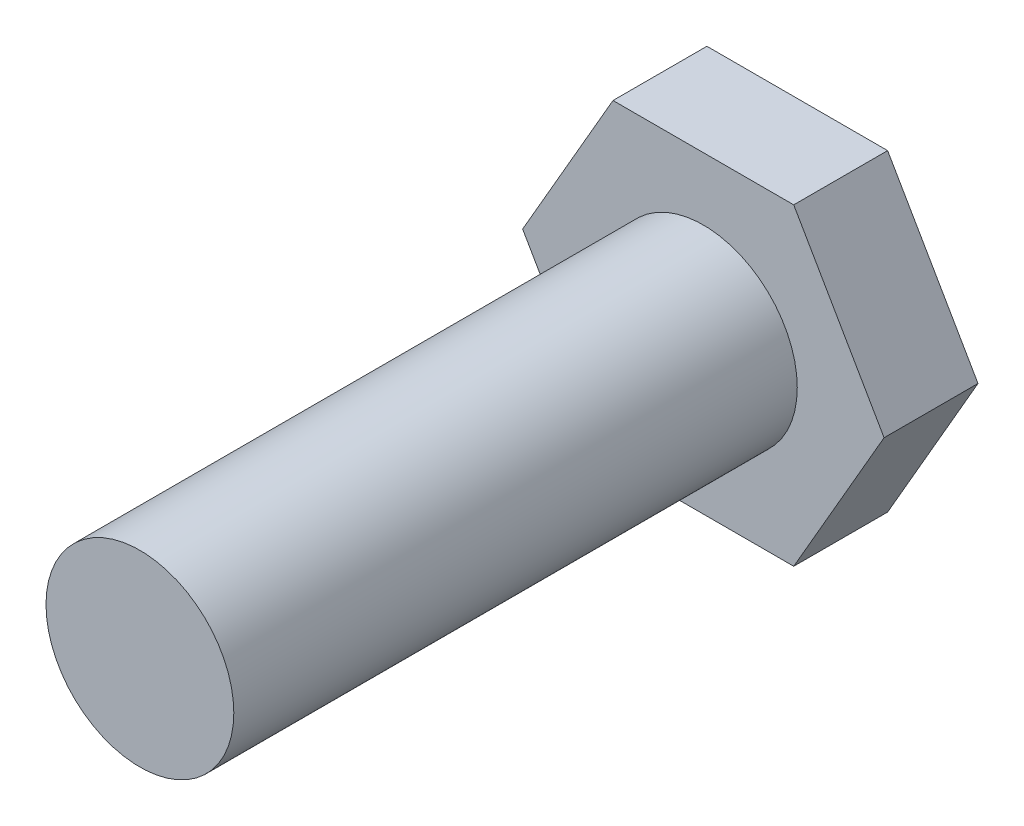
from build123d import *

# Parameters (mm, degrees)
BOSS_EXTRUDE1_DEPTH = 1.5
SKETCH3_R           = 1.5
BOSS_EXTRUDE2_DEPTH = 9


with BuildPart() as part:
    # Sketch2 → Boss-Extrude1 (new body)
    with BuildSketch(Plane.XY):
        Polygon((2.886751346, 0), (1.443375673, 2.5), (-1.443375673, 2.5), (-2.886751346, 0), (-1.443375673, -2.5), (1.443375673, -2.5), align=None)
    extrude(amount=BOSS_EXTRUDE1_DEPTH)

    # Sketch3 → Boss-Extrude2 (add)
    with BuildSketch(Plane.XY.offset(1.5)):
        Circle(SKETCH3_R)
    extrude(amount=BOSS_EXTRUDE2_DEPTH)


solid = part.part
